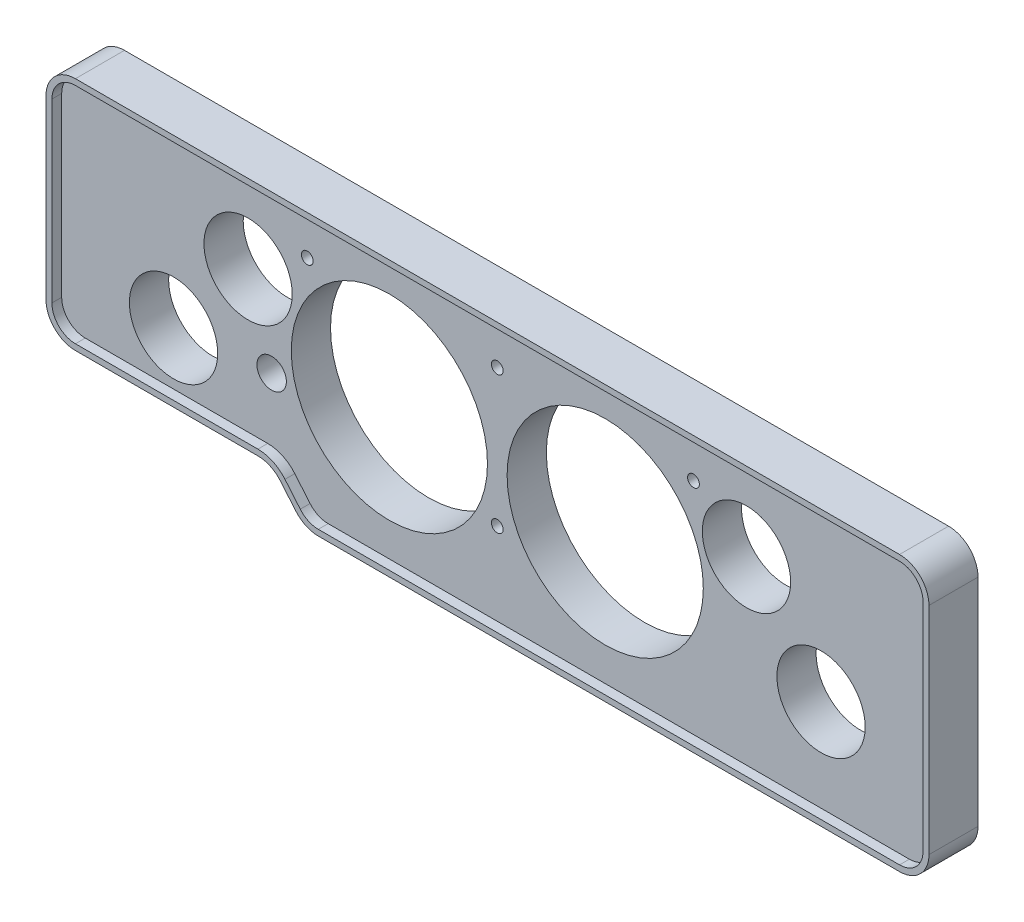
from build123d import *

# Parameters (mm, degrees)
BOSS_EXTRUDE1_DEPTH = 25
FILLET1_R           = 15
SKETCH2_R           = 50
SKETCH2_R_2         = 22.5
SKETCH2_R_3         = 7.5
CUT_EXTRUDE1_DEPTH  = 237.959912221
CUT_EXTRUDE2_DEPTH  = 5
SKETCH5_R           = 3
CUT_EXTRUDE3_DEPTH  = 12.7


with BuildPart() as part:
    # Sketch1 → Boss-Extrude1 (new body)
    with BuildSketch(Plane.XY):
        Polygon((-225, -50), (-110, -50), (-93.218007376, -70), (225, -70), (225, 70), (-225, 70), align=None)
    extrude(amount=-BOSS_EXTRUDE1_DEPTH)

    # Fillet1
    fillet1_edges = [part.edges().sort_by_distance(p)[0] for p in [
        (225, -70, -12.5),
        (-93.218007376, -70, -12.5),
        (-110, -50, -12.5),
        (-225, -50, -12.5),
        (-225, 70, -12.5),
        (225, 70, -12.5),
    ]]
    fillet(fillet1_edges, radius=FILLET1_R)

    # Sketch2 → Cut-Extrude1 (cut, through all)
    with BuildSketch(Plane.XY):
        with Locations((55, 0)):
            Circle(SKETCH2_R)
        with Locations((127, 25)):
            Circle(SKETCH2_R_2)
        with Locations((165, -20)):
            Circle(SKETCH2_R_2)
        with Locations(Location((-165, -20, 0), (0, 0, 180))):
            Circle(SKETCH2_R_2)
        with Locations(Location((-127, 25, 0), (0, 0, 180))):
            Circle(SKETCH2_R_2)
        with Locations(Location((-55, 0, 0), (0, 0, 180))):
            Circle(SKETCH2_R)
        with Locations((-115, -15)):
            Circle(SKETCH2_R_3)
    extrude(amount=-CUT_EXTRUDE1_DEPTH, mode=Mode.SUBTRACT)

    # Sketch4 → Cut-Extrude2 (cut)
    with BuildSketch(Plane.XY):
        with BuildLine():
            Line((-103.205814896, -53.429823026), (-95.415925822, -62.713451316))
            ThreePointArc((-95.415925822, -62.713451316), (-91.294811645, -65.875693444), (-86.223392504, -67))
            Line((-86.223392504, -67), (210, -67))
            ThreePointArc((210, -67), (218.485281374, -63.485281374), (222, -55))
            Line((222, -55), (222, 55))
            ThreePointArc((222, 55), (218.485281374, 63.485281374), (210, 67))
            Line((210, 67), (-210, 67))
            ThreePointArc((-210, 67), (-218.485281374, 63.485281374), (-222, 55))
            Line((-222, 55), (-222, -35))
            ThreePointArc((-222, -35), (-218.485281374, -43.485281374), (-210, -47))
            Line((-210, -47), (-116.994614872, -47))
            ThreePointArc((-116.994614872, -47), (-109.387486161, -48.686459833), (-103.205814896, -53.429823026))
        make_face()
    extrude(amount=-CUT_EXTRUDE2_DEPTH, mode=Mode.SUBTRACT)

    # Sketch5 → Cut-Extrude3 (cut)
    with BuildSketch(Plane.XY.offset(-5)):
        with Locations((0, 45)):
            Circle(SKETCH5_R)
        with Locations((0, -25)):
            Circle(SKETCH5_R)
        with Locations((100, 45)):
            Circle(SKETCH5_R)
        with Locations((-96.85, 45)):
            Circle(SKETCH5_R)
    extrude(amount=-CUT_EXTRUDE3_DEPTH, mode=Mode.SUBTRACT)


solid = part.part
